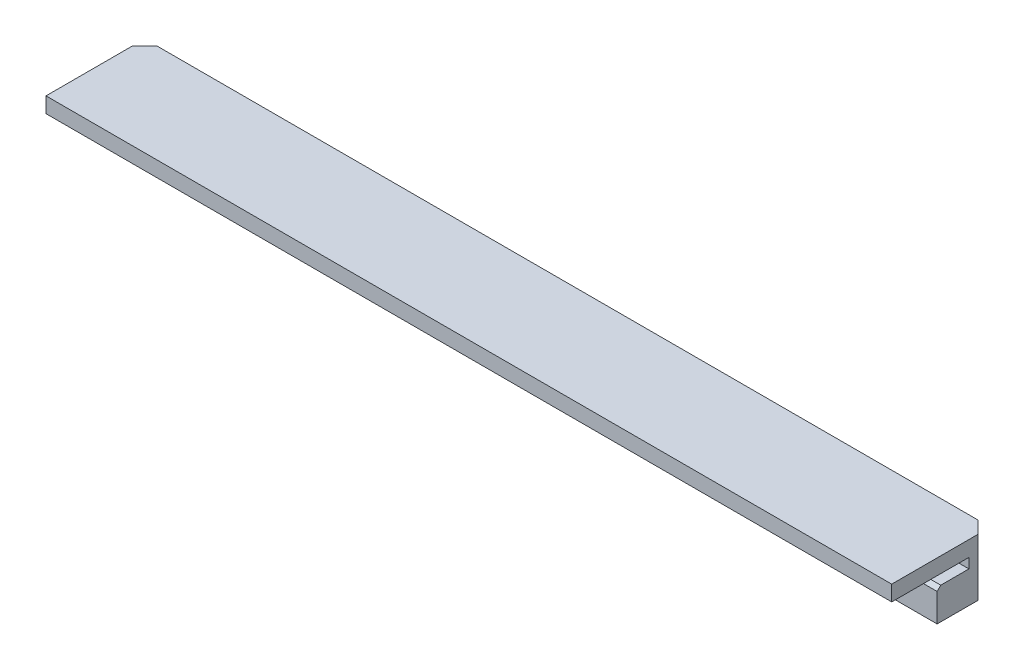
from build123d import *

# Parameters (mm, degrees)
SKETCH_2_W                  = 93.1
SKETCH_2_H                  = 10
EXTRUDE_1_DEPTH             = 3.5
SKETCH_4_W                  = 93.1
SKETCH_4_H                  = 6.5
EXTRUDE_2_DEPTH             = 1.1
SKETCH_5_W                  = 93.1
SKETCH_5_H                  = 10
EXTRUDE_3_DEPTH             = 2
CUT_EXTRUDE_1_DEPTH         = 94.867832616
SKETCH_7_W                  = 83.1
SKETCH_7_H                  = 1.1
EXTRUDE_4_DEPTH             = 3.5
CHAMFER_1_SIZE              = 0.4
CUT_EXTRUDE_2_REACH         = 95.868
SKETCH_8_R                  = 150
SKETCH_9_W                  = 93.1
SKETCH_9_H                  = 2
EXTRUDE_5_DEPTH             = 5
EXTRUDE_5_DIRECTION_2_REACH = 95.868
CUT_EXTRUDE_3_REACH         = 95.868
SKETCH_10_W                 = 11.362693304
SKETCH_10_H                 = 0.3
CUT_EXTRUDE_4_REACH         = 95.847
CUT_EXTRUDE_5_REACH         = 95.795


with BuildPart() as part:
    # 草图2 → 凸台-拉伸1 (new body)
    with BuildSketch(Plane(origin=(0, 0, 0), x_dir=(1, 0, 0), z_dir=(0, 1, 0))):
        with Locations((46.55, 5)):
            Rectangle(SKETCH_2_W, SKETCH_2_H)
    extrude(amount=EXTRUDE_1_DEPTH)

    # 草图4 → 凸台-拉伸2 (add)
    with BuildSketch(Plane(origin=(0, 3.5, 0), x_dir=(1, 0, 0), z_dir=(0, 1, 0))):
        with Locations((46.55, 6.75)):
            Rectangle(SKETCH_4_W, SKETCH_4_H)
    extrude(amount=EXTRUDE_2_DEPTH)

    # 草图5 → 凸台-拉伸3 (add)
    with BuildSketch(Plane(origin=(0, 4.6, 0), x_dir=(1, 0, 0), z_dir=(0, 1, 0))):
        with Locations((46.55, 5)):
            Rectangle(SKETCH_5_W, SKETCH_5_H)
    extrude(amount=EXTRUDE_3_DEPTH)

    # 草图6 → 切除-拉伸1 (cut, through all)
    with BuildSketch(Plane.ZY):
        Polygon((-10, 0), (-6.189488223, 6.6), (-10, 6.6), align=None)
    extrude(amount=-CUT_EXTRUDE_1_DEPTH, mode=Mode.SUBTRACT)

    # 草图7 → 凸台-拉伸4 (add)
    with BuildSketch(Plane.XY.offset(-3.5)):
        with Locations((46.55, 4.05)):
            Rectangle(SKETCH_7_W, SKETCH_7_H)
    extrude(amount=EXTRUDE_4_DEPTH)

    # 倒角1
    chamfer_1_edges = [part.edges().sort_by_distance(p)[0] for p in [
        (90.6, 3.5, 0),
        (2.5, 3.5, 0),
    ]]
    chamfer(chamfer_1_edges, length=CHAMFER_1_SIZE)

    # 草图8 → 切除-拉伸2 (cut, up to next)
    with BuildSketch(Plane.XZ, mode=Mode.PRIVATE) as cut_extrude_2_sk1:
        with Locations((46.55, 147)):
            Circle(SKETCH_8_R)
    cut_extrude_2_tool1 = extrude(cut_extrude_2_sk1.sketch, amount=-CUT_EXTRUDE_2_REACH, mode=Mode.PRIVATE) & part.part
    add(cut_extrude_2_tool1.solids().sort_by_distance((46.55, 0, 147))[0], mode=Mode.SUBTRACT)

    # 草图9 → 凸台-拉伸5 (add)
    with BuildSketch(Plane.XY):
        with Locations((46.55, 5.6)):
            Rectangle(SKETCH_9_W, SKETCH_9_H)
    extrude(amount=EXTRUDE_5_DEPTH)

    # 草图9 → 凸台-拉伸5 direction 2 (add, up to next)
    with BuildSketch(Plane.XY, mode=Mode.PRIVATE) as extrude_5_direction_2_sk1:
        with Locations((46.55, 5.6)):
            Rectangle(SKETCH_9_W, SKETCH_9_H)
    extrude_5_direction_2_tool1 = extrude(extrude_5_direction_2_sk1.sketch, amount=-EXTRUDE_5_DIRECTION_2_REACH, mode=Mode.PRIVATE) - part.part
    add(extrude_5_direction_2_tool1.solids().sort_by_distance((46.55, 5.6, 0))[0])

    # 草图10 → 切除-拉伸3 (cut, up to next)
    with BuildSketch(Plane(origin=(93.1, 0, 0), x_dir=(0, 0, -1), z_dir=(1, 0, 0)), mode=Mode.PRIVATE) as cut_extrude_3_sk1:
        with Locations((0.681346652, 6.45)):
            Rectangle(SKETCH_10_W, SKETCH_10_H)
    cut_extrude_3_tool1 = extrude(cut_extrude_3_sk1.sketch, amount=-CUT_EXTRUDE_3_REACH, mode=Mode.PRIVATE) & part.part
    add(cut_extrude_3_tool1.solids().sort_by_distance((93.1, 6.45, -0.681347))[0], mode=Mode.SUBTRACT)

    # 草图11 → 切除-拉伸4 (cut, up to next)
    with BuildSketch(Plane(origin=(93.1, 0, 0), x_dir=(0, 0, -1), z_dir=(1, 0, 0)), mode=Mode.PRIVATE) as cut_extrude_4_sk1:
        Polygon((6.362693304, 6.3), (5.862693304, 6.3), (9.5, 0), (10, 0), align=None)
    cut_extrude_4_tool1 = extrude(cut_extrude_4_sk1.sketch, amount=-CUT_EXTRUDE_4_REACH, mode=Mode.PRIVATE) & part.part
    add(cut_extrude_4_tool1.solids().sort_by_distance((93.1, 3.15, -7.931347))[0], mode=Mode.SUBTRACT)

    # 草图12 → 切除-拉伸5 (cut, up to next)
    with BuildSketch(Plane(origin=(0, 0, 0), x_dir=(1, 0, 0), z_dir=(0, 1, 0)), mode=Mode.PRIVATE) as cut_extrude_5_sk1:
        Polygon((0, 9.5), (5, 9.5), (0, 4.5), align=None)
    cut_extrude_5_tool1 = extrude(cut_extrude_5_sk1.sketch, amount=CUT_EXTRUDE_5_REACH, mode=Mode.PRIVATE) & part.part
    # 草图12 → 切除-拉伸5 (cut, up to next)
    with BuildSketch(Plane(origin=(0, 0, 0), x_dir=(1, 0, 0), z_dir=(0, 1, 0)), mode=Mode.PRIVATE) as cut_extrude_5_sk2:
        Polygon((93.1, 4.5), (93.1, 9.5), (88.1, 9.5), align=None)
    cut_extrude_5_tool2 = extrude(cut_extrude_5_sk2.sketch, amount=CUT_EXTRUDE_5_REACH, mode=Mode.PRIVATE) & part.part
    add(cut_extrude_5_tool1.solids().sort_by_distance((1.666667, 0, -7.833333))[0], mode=Mode.SUBTRACT)
    add(cut_extrude_5_tool2.solids().sort_by_distance((91.433333, 0, -7.833333))[0], mode=Mode.SUBTRACT)


solid = part.part
